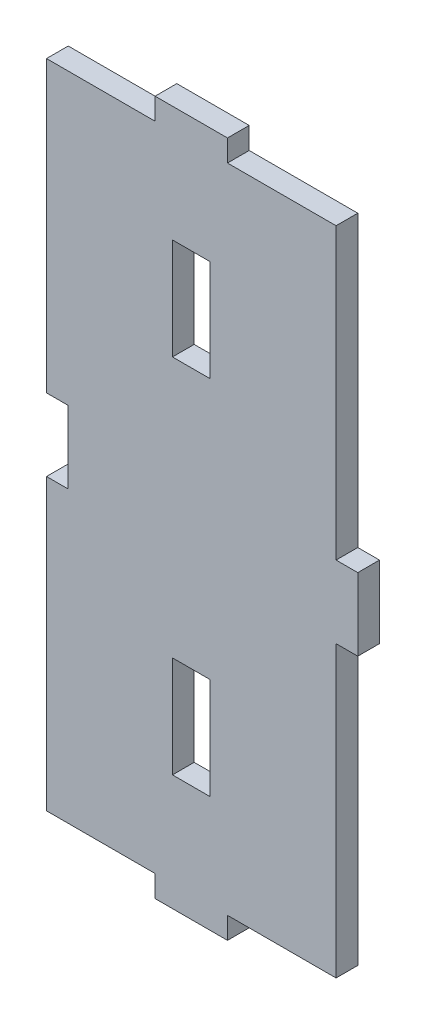
from build123d import *

# Parameters (mm, degrees)
SKETCH1_W           = 5.2
SKETCH1_H           = 14
BOSS_EXTRUDE1_DEPTH = 3


with BuildPart() as part:
    # Sketch1 → Boss-Extrude1 (new body)
    with BuildSketch(Plane.XY):
        Polygon((0, 45.197047181), (15, 45.197047181), (15, 48.197047181), (25, 48.197047181), (25, 45.197047181), (40, 45.197047181), (40, 5.197047181), (43, 5.197047181), (43, -4.802952819), (40, -4.802952819), (40, -44.802952819), (25, -44.802952819), (25, -47.802952819), (15, -47.802952819), (15, -44.802952819), (0, -44.802952819), (0, -4.802952819), (3, -4.802952819), (3, 5.197047181), (0, 5.197047181), align=None)
        with Locations((20, 25.197047181)):
            Rectangle(SKETCH1_W, SKETCH1_H, mode=Mode.SUBTRACT)
        with Locations((20, -24.802952819)):
            Rectangle(SKETCH1_W, SKETCH1_H, mode=Mode.SUBTRACT)
    extrude(amount=BOSS_EXTRUDE1_DEPTH)


solid = part.part
